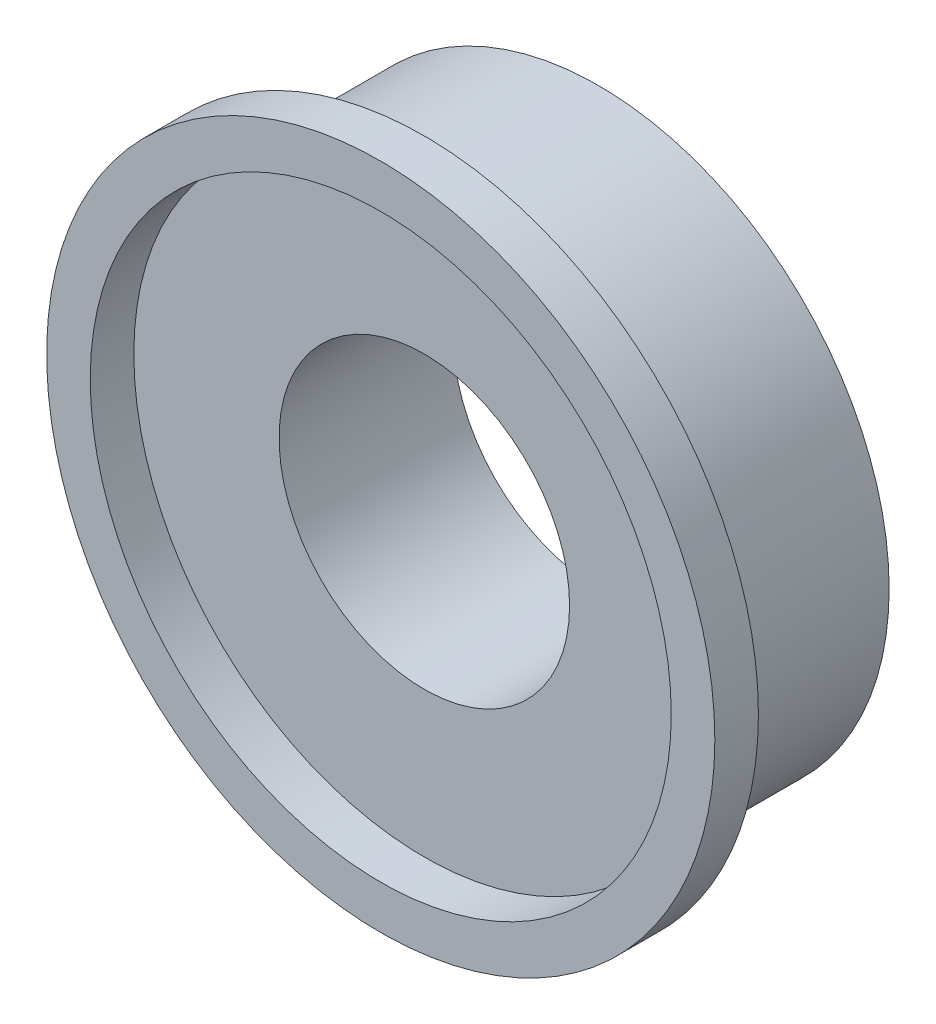
from build123d import *

# Parameters (mm, degrees)
IZIM1_R                     = 4
IZIM1_R_2                   = 2
Y_KSEKLIK_EKSTR_ZYON1_DEPTH = 2.4
IZIM2_R                     = 4.6
IZIM2_R_2                   = 4
Y_KSEKLIK_EKSTR_ZYON2_DEPTH = 0.6


with BuildPart() as part:
    # Çizim1 → Yükseklik-Ekstrüzyon1 (new body)
    with BuildSketch(Plane.XY):
        Circle(IZIM1_R)
        Circle(IZIM1_R_2, mode=Mode.SUBTRACT)
    extrude(amount=Y_KSEKLIK_EKSTR_ZYON1_DEPTH)


with BuildPart() as body_2:
    # Çizim2 → Yükseklik-Ekstrüzyon2 (new body)
    with BuildSketch(Plane.XY.offset(2.4)):
        Circle(IZIM2_R)
        Circle(IZIM2_R_2, mode=Mode.SUBTRACT)
    extrude(amount=Y_KSEKLIK_EKSTR_ZYON2_DEPTH)


solid = Compound([part.part, body_2.part])
